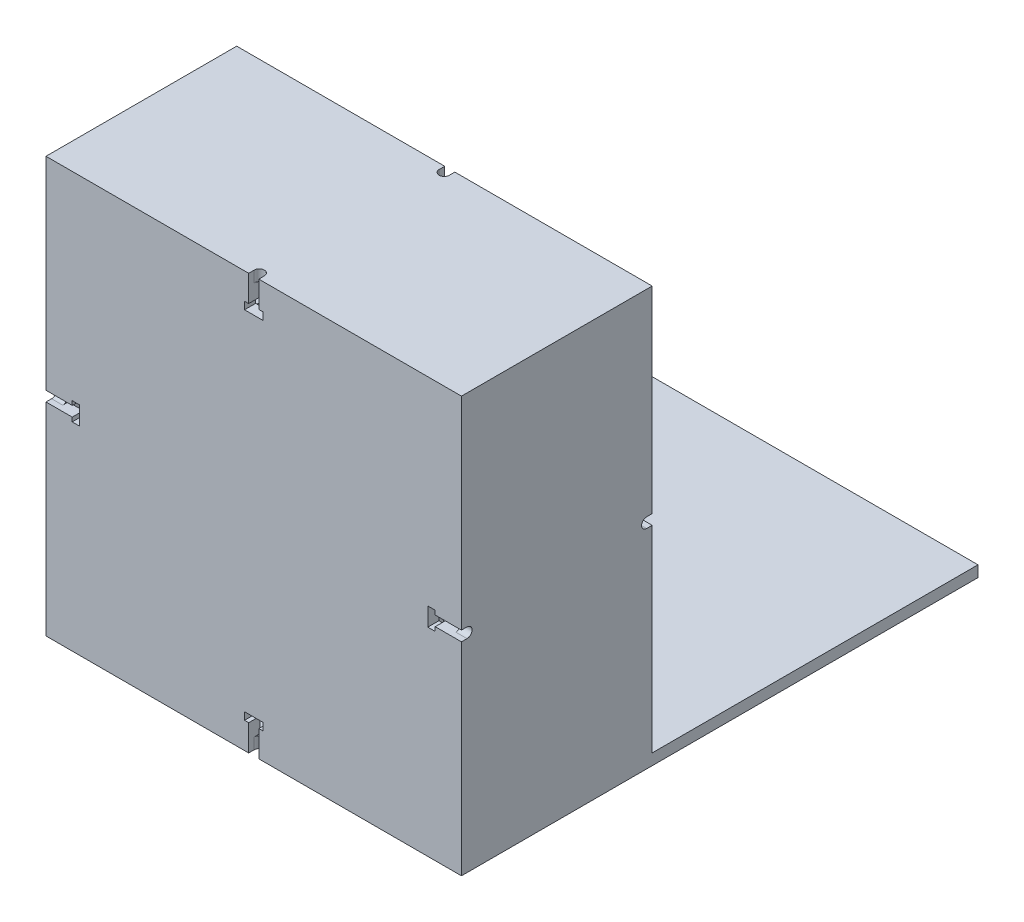
from build123d import *

# Parameters (mm, degrees)
SCHIZZO2_W                   = 123.3
SCHIZZO2_H                   = 123.3
ESTRUSIONE_ESTRUSIONE2_DEPTH = 53.3
SVUOTA1_T                    = -3.3
TAGLIO_ESTRUSIONE2_DEPTH     = 3.3
TAGLIO_ESTRUSIONE6_DEPTH     = 3.3
TAGLIO_ESTRUSIONE7_START     = 3.3
TAGLIO_ESTRUSIONE7_DEPTH     = 3.3
TAGLIO_ESTRUSIONE8_DEPTH     = 3.3
TAGLIO_ESTRUSIONE9_START     = -3.3
TAGLIO_ESTRUSIONE9_DEPTH     = 3.3
ESTRUSIONE_ESTRUSIONE5_DEPTH = 100
ESTRUSIONE_ESTRUSIONE7_DEPTH = 123.3
TAGLIO_ESTRUSIONE19_DEPTH    = 3.3
TAGLIO_ESTRUSIONE20_DEPTH    = 3.3
TAGLIO_ESTRUSIONE21_START    = -3.3
TAGLIO_ESTRUSIONE21_DEPTH    = 3.3
TAGLIO_ESTRUSIONE22_DEPTH    = 3.3
TAGLIO_ESTRUSIONE23_DEPTH    = 3.3
TAGLIO_ESTRUSIONE24_DEPTH    = 3.3


with BuildPart() as part:
    # Schizzo2 → Estrusione-Estrusione2 (new body)
    with BuildSketch(Plane.XY):
        with Locations((61.65, 61.65)):
            Rectangle(SCHIZZO2_W, SCHIZZO2_H)
    extrude(amount=-ESTRUSIONE_ESTRUSIONE2_DEPTH)

    # Svuota1
    svuota1_openings = [part.faces().sort_by_distance(p)[0] for p in [
        (61.65, 61.65, -53.3),
    ]]
    offset(amount=SVUOTA1_T, openings=svuota1_openings, kind=Kind.INTERSECTION)

    # Schizzo3D1 → Taglio-Estrusione2 (cut)
    with BuildSketch(Plane(origin=(123.3, 60.15, -1.65), x_dir=(0, 0.8762159086766463, 0.48191874977215726), z_dir=(1, 0, 0))):
        with BuildLine():
            Line((0, 0), (0.795165937, 1.445756249))
            Line((0.795165937, 1.445756249), (3.423813663, 0))
            Line((3.423813663, 0), (2.628647726, -1.445756249))
            ThreePointArc((2.628647726, -1.445756249), (0.591445738, -2.037201988), (0, 0))
        make_face()
    extrude(amount=-TAGLIO_ESTRUSIONE2_DEPTH, mode=Mode.SUBTRACT)

    # Schizzo6 → Taglio-Estrusione6 (cut)
    with BuildSketch(Plane.XY):
        Polygon((120, 60.15), (115.51, 60.15), (115.51, 58.92), (113.3, 58.92), (113.3, 64.38), (115.51, 64.38), (115.51, 63.15), (120, 63.15), align=None)
        Polygon((3.3, 63.15), (3.3, 60.15), (7.79, 60.15), (7.79, 58.92), (10, 58.92), (10, 64.38), (7.79, 64.38), (7.79, 63.15), align=None)
        Polygon((60.15, 3.3), (63.15, 3.3), (63.15, 7.79), (64.38, 7.79), (64.38, 10), (58.92, 10), (58.92, 7.79), (60.15, 7.79), align=None)
        Polygon((63.15, 120), (60.15, 120), (60.15, 115.51), (58.92, 115.51), (58.92, 113.3), (64.38, 113.3), (64.38, 115.51), (63.15, 115.51), align=None)
    extrude(amount=-TAGLIO_ESTRUSIONE6_DEPTH, mode=Mode.SUBTRACT)

    # Schizzo3D6 → Taglio-Estrusione7 (cut)
    with BuildSketch(Plane(origin=(0, 61.65, 0), x_dir=(0, -0.6726727939963129, -0.7399400733959435), z_dir=(1, 0, 0)).offset(TAGLIO_ESTRUSIONE7_START)):
        with BuildLine():
            Line((0, 0), (1.009009191, -1.10991011))
            Line((1.009009191, -1.10991011), (2.229910312, 0))
            ThreePointArc((2.229910312, 0), (2.321673153, 2.128880637), (0.192052014, 2.201454665))
            Line((0.192052014, 2.201454665), (-1.008845302, 1.109729832))
            Line((-1.008845302, 1.109729832), (0, 0))
        make_face()
    extrude(amount=-TAGLIO_ESTRUSIONE7_DEPTH, mode=Mode.SUBTRACT)

    # Schizzo3D7 → Taglio-Estrusione8 (cut)
    with BuildSketch(Plane(origin=(60.15, 0, 0), x_dir=(0.8760258326495893, 2.026216235651821e-15, -0.48226418126437076), z_dir=(0, -1, 0))):
        with BuildLine():
            Line((0, 0), (2.629562684, 1.447610159))
            Line((2.629562684, 1.447610159), (3.424555643, 0))
            ThreePointArc((3.424555643, 0), (2.832496055, -2.036456397), (0.795735899, -1.445442624))
            Line((0.795735899, -1.445442624), (0, 0))
        make_face()
    extrude(amount=-TAGLIO_ESTRUSIONE8_DEPTH, mode=Mode.SUBTRACT)

    # Schizzo3D8 → Taglio-Estrusione9 (cut)
    with BuildSketch(Plane(origin=(63.15, 123.3, 0), x_dir=(-0.8762159086766472, 0, -0.48191874977215554), z_dir=(0, 1, 0)).offset(TAGLIO_ESTRUSIONE9_START)):
        with BuildLine():
            Line((0, 0), (2.628647726, 1.445756249))
            Line((2.628647726, 1.445756249), (3.423813663, 0))
            ThreePointArc((3.423813663, 0), (2.832367925, -2.037201988), (0.795165937, -1.445756249))
            Line((0.795165937, -1.445756249), (0, 0))
        make_face()
    extrude(amount=TAGLIO_ESTRUSIONE9_DEPTH, mode=Mode.SUBTRACT)

    # Schizzo3D9 → Estrusione-Estrusione5 (add)
    with BuildSketch(Plane(origin=(120, 3.3, -53.3), x_dir=(-0.9996220893327035, -0.02748960745664935, 0), z_dir=(0, 0, 1))):
        Polygon((0, 0), (-3.298752895, 0.090715705), (-3.20803719, 3.389468599), (120.045366425, 0), (119.95465072, -3.298752895), (116.655897825, -3.20803719), align=None)
    extrude(amount=-ESTRUSIONE_ESTRUSIONE5_DEPTH)

    # Schizzo3D10 → Estrusione-Estrusione7 (add)
    with BuildSketch(Plane(origin=(123.3, 123.3, -53.3), x_dir=(0, -0.9996220893327035, -0.027489607456649322), z_dir=(-1, 0, 0))):
        Polygon((0, 0), (0.090715705, -3.298752895), (120.045366425, 0), (119.95465072, 3.298752895), align=None)
    extrude(amount=ESTRUSIONE_ESTRUSIONE7_DEPTH)

    # Schizzo14 → Taglio-Estrusione19 (cut)
    with BuildSketch(Plane.ZY):
        with BuildLine():
            Line((-56.6, 64.8), (-56.6, 61.8))
            Line((-56.6, 61.8), (-54.95, 61.8))
            ThreePointArc((-54.95, 61.8), (-53.45, 63.3), (-54.95, 64.8))
            Line((-54.95, 64.8), (-56.6, 64.8))
        make_face()
    extrude(amount=-TAGLIO_ESTRUSIONE19_DEPTH, mode=Mode.SUBTRACT)

    # Schizzo21 → Taglio-Estrusione20 (cut)
    with BuildSketch(Plane(origin=(0, 0, 0), x_dir=(-1, 0, 0), z_dir=(0, -1, 0))):
        with BuildLine():
            Line((-64.335889046, 56.848416793), (-64.335889046, 55.198416793))
            ThreePointArc((-64.335889046, 55.198416793), (-62.835889046, 53.698416793), (-61.335889046, 55.198416793))
            Line((-61.335889046, 55.198416793), (-61.335889046, 56.848416793))
            Line((-61.335889046, 56.848416793), (-64.335889046, 56.848416793))
        make_face()
    extrude(amount=-TAGLIO_ESTRUSIONE20_DEPTH, mode=Mode.SUBTRACT)

    # Schizzo17 → Taglio-Estrusione21 (cut)
    with BuildSketch(Plane(origin=(123.3, 0, 0), x_dir=(0, 0, -1), z_dir=(1, 0, 0)).offset(TAGLIO_ESTRUSIONE21_START)):
        with BuildLine():
            Line((56.6, 64.8), (56.6, 61.8))
            Line((56.6, 61.8), (54.95, 61.8))
            ThreePointArc((54.95, 61.8), (53.45, 63.3), (54.95, 64.8))
            Line((54.95, 64.8), (56.6, 64.8))
        make_face()
    extrude(amount=TAGLIO_ESTRUSIONE21_DEPTH, mode=Mode.SUBTRACT)

    # Schizzo24 → Taglio-Estrusione22 (cut)
    with BuildSketch(Plane(origin=(0, 123.3, 0), x_dir=(1, 0, 0), z_dir=(0, 1, 0))):
        with BuildLine():
            Line((61.734441738, 56.603992056), (61.734441738, 54.953992056))
            ThreePointArc((61.734441738, 54.953992056), (63.234441738, 53.453992056), (64.734441738, 54.953992056))
            Line((64.734441738, 54.953992056), (64.734441738, 56.603992056))
            Line((64.734441738, 56.603992056), (61.734441738, 56.603992056))
        make_face()
    extrude(amount=-TAGLIO_ESTRUSIONE22_DEPTH, mode=Mode.SUBTRACT)

    # Schizzo26 → Taglio-Estrusione23 (cut)
    with BuildSketch(Plane(origin=(0, 0, -56.6), x_dir=(-1, 0, 0), z_dir=(0, 0, -1))):
        Polygon((-61.734441738, 120), (-61.734441738, 115.51), (-60.504441738, 115.51), (-60.504441738, 113.3), (-65.964441738, 113.3), (-65.964441738, 115.51), (-64.734441738, 115.51), (-64.734441738, 120), align=None)
    extrude(amount=-TAGLIO_ESTRUSIONE23_DEPTH, mode=Mode.SUBTRACT)

    # Schizzo28 → Taglio-Estrusione24 (cut)
    with BuildSketch(Plane(origin=(0, 0, -56.6), x_dir=(-1, 0, 0), z_dir=(0, 0, -1))):
        Polygon((-120, 61.8), (-115.51, 61.8), (-115.51, 60.57), (-113.3, 60.57), (-113.3, 66.03), (-115.51, 66.03), (-115.51, 64.8), (-120, 64.8), align=None)
        Polygon((-3.3, 64.8), (-7.79, 64.8), (-7.79, 66.03), (-10, 66.03), (-10, 60.57), (-7.79, 60.57), (-7.79, 61.8), (-3.3, 61.8), align=None)
        Polygon((-64.335889046, 3.3), (-64.335889046, 7.79), (-65.565889046, 7.79), (-65.565889046, 10), (-60.105889046, 10), (-60.105889046, 7.79), (-61.335889046, 7.79), (-61.335889046, 3.3), align=None)
    extrude(amount=-TAGLIO_ESTRUSIONE24_DEPTH, mode=Mode.SUBTRACT)


solid = part.part
